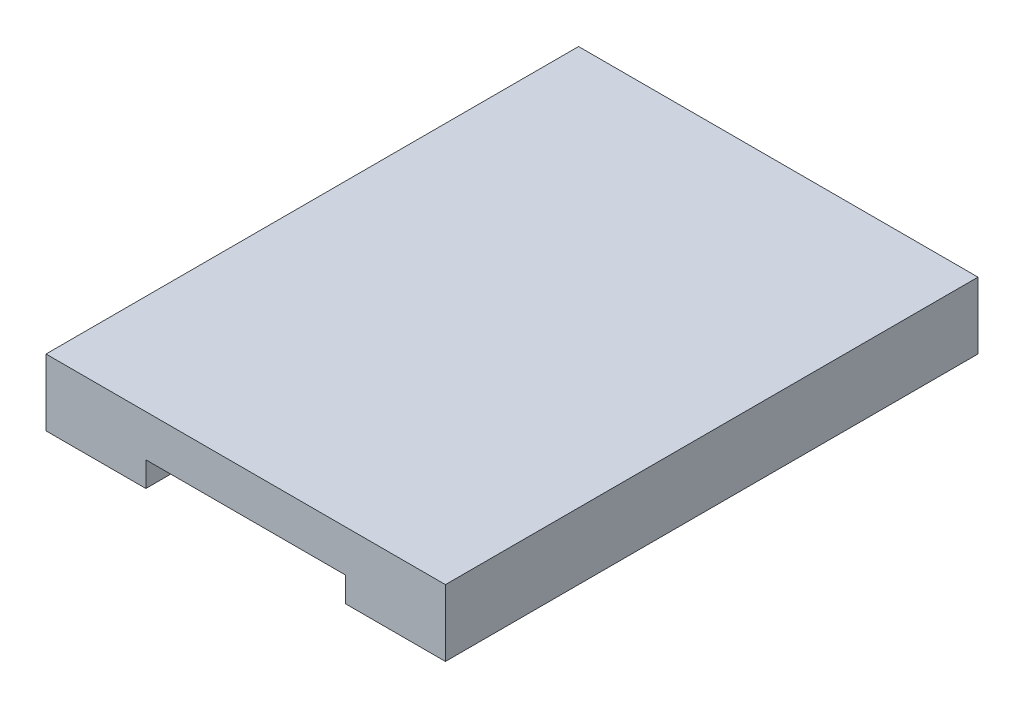
from build123d import *

# Parameters (mm, degrees)
SKETCH1_W           = 76.2
SKETCH1_H           = 101.6
BOSS_EXTRUDE1_DEPTH = 12.7
SKETCH2_W           = 38.1
SKETCH2_H           = 20.6502
CUT_EXTRUDE1_DEPTH  = 4.7498
SKETCH3_R           = 3.81
CUT_EXTRUDE2_DEPTH  = 6.35


with BuildPart() as part:
    # Sketch1 → Boss-Extrude1 (new body)
    with BuildSketch(Plane(origin=(0, 0, 0), x_dir=(1, 0, 0), z_dir=(0, 1, 0))):
        Rectangle(SKETCH1_W, SKETCH1_H)
    extrude(amount=BOSS_EXTRUDE1_DEPTH)

    # Sketch2 → Cut-Extrude1 (cut)
    with BuildSketch(Plane.XZ):
        with Locations((0, 40.4749)):
            Rectangle(SKETCH2_W, SKETCH2_H)
    extrude(amount=-CUT_EXTRUDE1_DEPTH, mode=Mode.SUBTRACT)

    # Sketch3 → Cut-Extrude2 (cut)
    with BuildSketch(Plane(origin=(0, 0, -50.8), x_dir=(-1, 0, 0), z_dir=(0, 0, -1))):
        with Locations((0, 6.35)):
            Circle(SKETCH3_R)
    extrude(amount=-CUT_EXTRUDE2_DEPTH, mode=Mode.SUBTRACT)


solid = part.part
